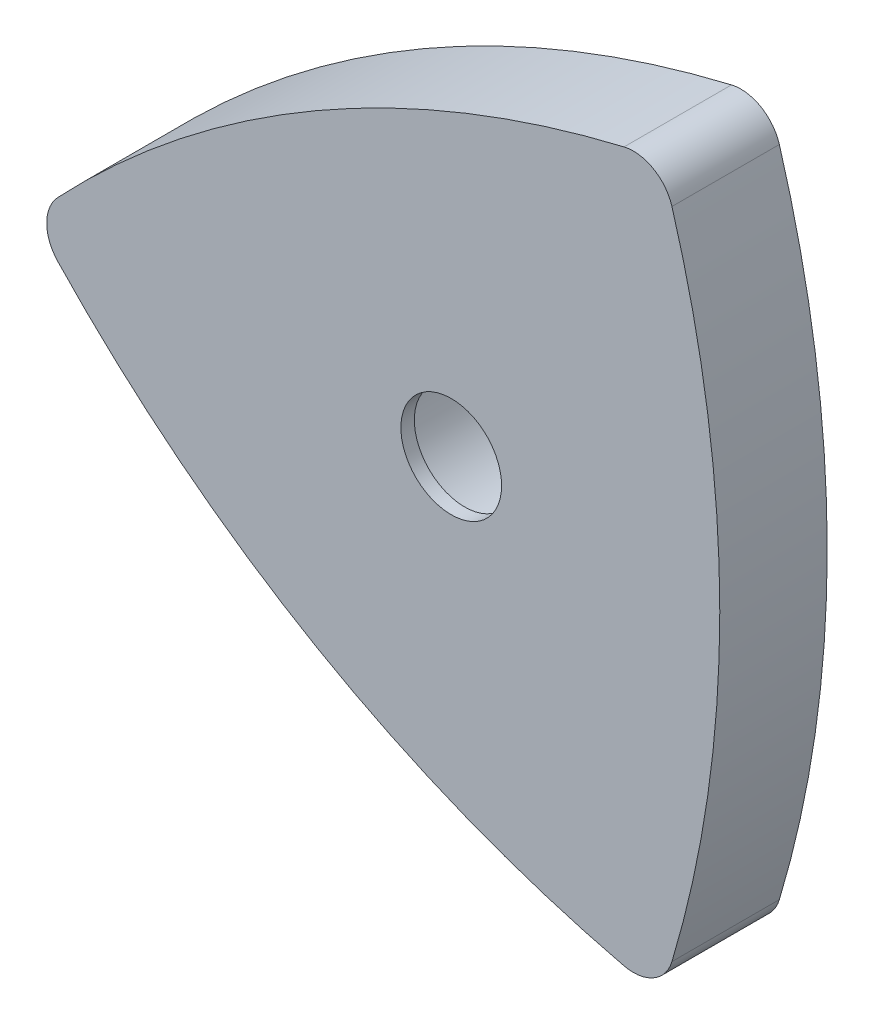
from build123d import *

# Parameters (mm, degrees)
ESQUISSE1_R             = 7.5
BASE_EXTRUSION_DEPTH    = 16
ESQUISSE2_R             = 13
ENL_V_MAT_EXTRU_2_DEPTH = 14


with BuildPart() as part:
    # Esquisse1 → Base-Extrusion (new body)
    with BuildSketch(Plane.XY):
        with BuildLine():
            ThreePointArc((25.740280008, -52.821275395), (-20, -34.641016151), (-58.614706356, -4.118901311))
            ThreePointArc((-58.614706356, -4.118901311), (-60.251834367, 0), (-58.614706356, 4.118901311))
            ThreePointArc((-58.614706356, 4.118901311), (-20, 34.641016151), (25.740280008, 52.821275395))
            ThreePointArc((25.740280008, 52.821275395), (30.125917184, 52.179619187), (32.874426349, 48.702374085))
            ThreePointArc((32.874426349, 48.702374085), (40, 0), (32.874426349, -48.702374085))
            ThreePointArc((32.874426349, -48.702374085), (30.125917184, -52.179619187), (25.740280008, -52.821275395))
        make_face()
        Circle(ESQUISSE1_R, mode=Mode.SUBTRACT)
    extrude(amount=BASE_EXTRUSION_DEPTH)

    # Esquisse2 → Enlèv. mat.-Extru.2 (cut)
    with BuildSketch(Plane.XY):
        Circle(ESQUISSE2_R)
    extrude(amount=ENL_V_MAT_EXTRU_2_DEPTH, mode=Mode.SUBTRACT)


solid = part.part
